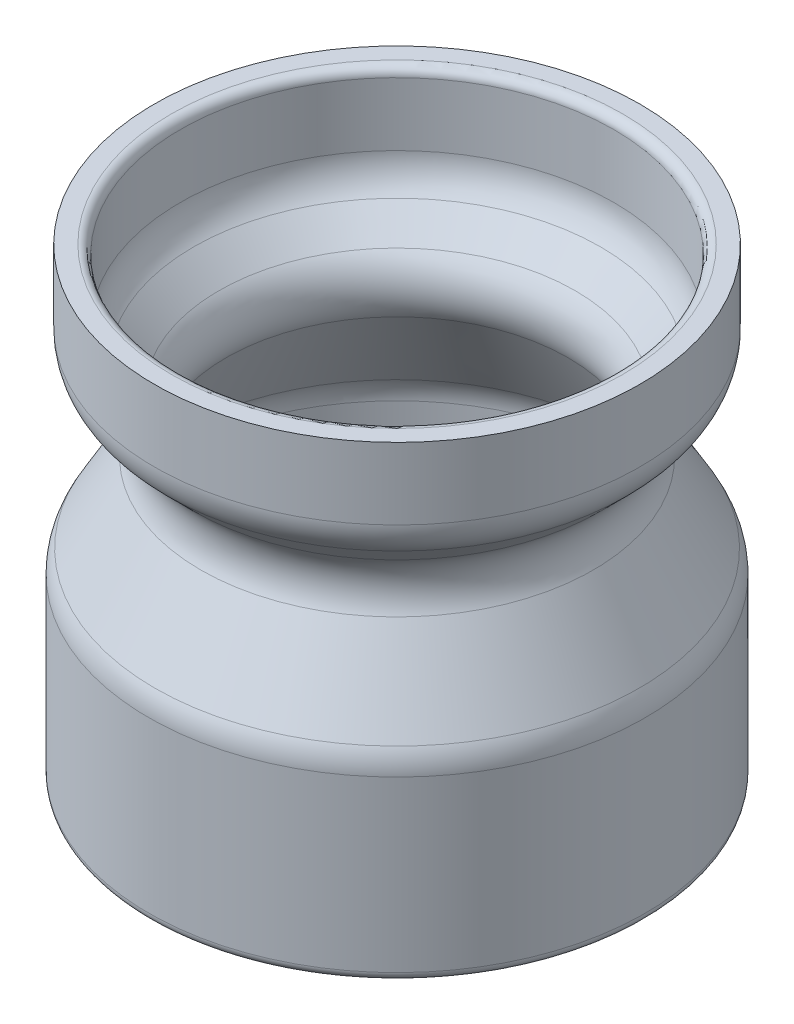
from build123d import *

# Parameters (mm, degrees)
CUT_EXTRUDE_2_REACH = 61.821
CUT_EXTRUDE_4_REACH = 66.498


with BuildPart() as part:
    # 草圖6 → 旋轉1 (revolve)
    with BuildSketch(Plane.XY, mode=Mode.PRIVATE) as revolve_1_sk:
        with BuildLine():
            Line((-2.5, 0), (-26.5, 0))
            ThreePointArc((-26.5, 0), (-27.207106781, 0.292893219), (-27.5, 1))
            Line((-27.5, 1), (-27.5, 19.759410868))
            ThreePointArc((-27.5, 19.759410868), (-27.329629131, 21.053506094), (-26.830127019, 22.259410868))
            Line((-26.830127019, 22.259410868), (-21.749089205, 31.060026518))
            ThreePointArc((-21.749089205, 31.060026518), (-21.121991917, 34.212657479), (-22.543682318, 37.095560424))
            Line((-22.543682318, 37.095560424), (-25.437373452, 39.989251558))
            ThreePointArc((-25.437373452, 39.989251558), (-26.521237209, 41.611368303), (-26.901839547, 43.524785464))
            Line((-26.901839547, 43.524785464), (-26.901839547, 51.453717653))
            Line((-26.901839547, 51.453717653), (-25.008799303, 51.453717653))
            ThreePointArc((-25.008799303, 51.453717653), (-24.301692522, 51.160824434), (-24.008799303, 50.453717653))
            Line((-24.008799303, 50.453717653), (-24.008799303, 43.460172345))
            ThreePointArc((-24.008799303, 43.460172345), (-23.628196965, 41.546755184), (-22.544333209, 39.92463844))
            Line((-22.544333209, 39.92463844), (-19.741742453, 37.122047684))
            ThreePointArc((-19.741742453, 37.122047684), (-18.320052052, 34.239144739), (-18.94714934, 31.086513778))
            Line((-18.94714934, 31.086513778), (-24.830127019, 20.896897538))
            ThreePointArc((-24.830127019, 20.896897538), (-25.329629131, 19.690992764), (-25.5, 18.396897538))
            Line((-25.5, 18.396897538), (-25.5, 3))
            ThreePointArc((-25.5, 3), (-25.207106781, 2.292893219), (-24.5, 2))
            Line((-24.5, 2), (-2.5, 2))
            Line((-2.5, 2), (-2.5, 0))
        make_face()
        with BuildLine():
            Line((-2.5, 4), (-2.5, 6))
            Line((-2.5, 6), (-24, 6))
            ThreePointArc((-24, 6), (-24.353553391, 5.853553391), (-24.5, 5.5))
            Line((-24.5, 5.5), (-24.5, 4.5))
            ThreePointArc((-24.5, 4.5), (-24.353553391, 4.146446609), (-24, 4))
            Line((-24, 4), (-2.5, 4))
        make_face()
    revolve(revolve_1_sk.sketch.rotate(Axis((0, 0, 0), (0, 1, 0)), 270), axis=Axis((0, 0, 0), (0, 1, 0)))

    # 草圖7 → 除料-伸長2 (cut, up to next)
    with BuildSketch(Plane(origin=(0, 6, 0), x_dir=(1, 0, 0), z_dir=(0, 1, 0)), mode=Mode.PRIVATE) as cut_extrude_2_sk1:
        with BuildLine():
            Line((13, -3.9), (13, 4.1))
            ThreePointArc((13, 4.1), (15, 6.1), (17, 4.1))
            Line((17, 4.1), (17, -3.9))
            ThreePointArc((17, -3.9), (15, -5.9), (13, -3.9))
        make_face()
    cut_extrude_2_tool1 = extrude(cut_extrude_2_sk1.sketch, amount=-CUT_EXTRUDE_2_REACH, mode=Mode.PRIVATE) & part.part
    add(cut_extrude_2_tool1.solids().sort_by_distance((15, 6, -0.1))[0], mode=Mode.SUBTRACT)

    # 草圖8 → 除料-伸長4 (cut, up to next)
    with BuildSketch(Plane.XZ, mode=Mode.PRIVATE) as cut_extrude_4_sk1:
        with BuildLine():
            Line((-17, -3.9), (-17, 4.1))
            ThreePointArc((-17, 4.1), (-15, 6.1), (-13, 4.1))
            Line((-13, 4.1), (-13, -3.9))
            ThreePointArc((-13, -3.9), (-15, -5.9), (-17, -3.9))
        make_face()
    cut_extrude_4_tool1 = extrude(cut_extrude_4_sk1.sketch, amount=-CUT_EXTRUDE_4_REACH, mode=Mode.PRIVATE) & part.part
    add(cut_extrude_4_tool1.solids().sort_by_distance((-15, 0, 0.1))[0], mode=Mode.SUBTRACT)


solid = part.part
